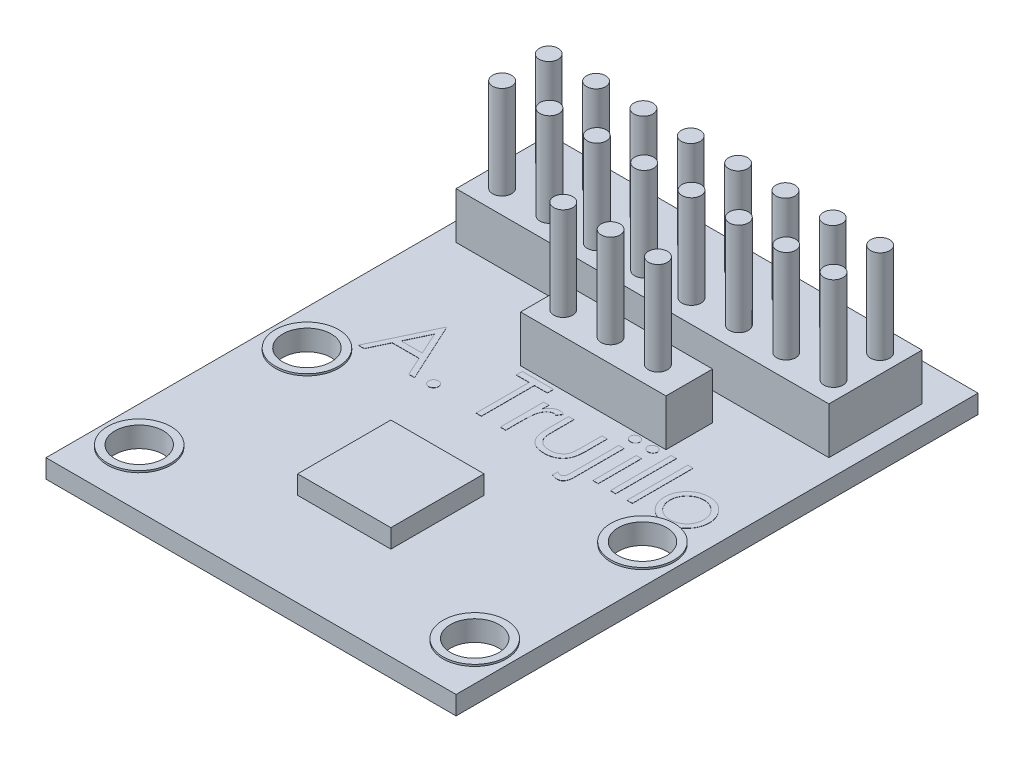
from build123d import *

# Parameters (mm, degrees)
SKETCH1_W           = 22
SKETCH1_H           = 28
BOSS_EXTRUDE1_DEPTH = 1
SKETCH2_W           = 20
SKETCH2_H           = 5
BOSS_EXTRUDE2_DEPTH = 2.5
SKETCH3_R           = 0.51
BOSS_EXTRUDE3_DEPTH = 5
SKETCH4_W           = 5
SKETCH4_H           = 5
BOSS_EXTRUDE4_DEPTH = 1
SKETCH5_R           = 1.3
CUT_EXTRUDE1_DEPTH  = 1
BOSS_EXTRUDE5_START = 0.1
SKETCH6_R           = 1.7
SKETCH6_R_2         = 1.3
BOSS_EXTRUDE5_DEPTH = 0.1
SKETCH7_W           = 7.8
SKETCH7_H           = 2.5
BOSS_EXTRUDE6_DEPTH = 2.5
SKETCH8_R           = 0.51
BOSS_EXTRUDE7_DEPTH = 5
SKETCH9_W           = 0.284935898
SKETCH9_H           = 2.320192308
SKETCH9_W_2         = 0.284935897
SKETCH9_H_2         = 3.256410256
BOSS_EXTRUDE8_DEPTH = 0.01


with BuildPart() as part:
    # Sketch1 → Boss-Extrude1 (new body)
    with BuildSketch(Plane(origin=(0, 0, 0), x_dir=(1, 0, 0), z_dir=(0, 1, 0))):
        Rectangle(SKETCH1_W, SKETCH1_H)
    extrude(amount=BOSS_EXTRUDE1_DEPTH)

    # Sketch2 → Boss-Extrude2 (add)
    with BuildSketch(Plane(origin=(0, 1, 0), x_dir=(1, 0, 0), z_dir=(0, 1, 0))):
        with Locations((0, 9.5)):
            Rectangle(SKETCH2_W, SKETCH2_H)
    extrude(amount=BOSS_EXTRUDE2_DEPTH)

    # Sketch3 → Boss-Extrude3 (add)
    with BuildSketch(Plane(origin=(0, 3.5, 0), x_dir=(1, 0, 0), z_dir=(0, 1, 0))):
        with Locations(Location((9, 8.25, 0), (0, 0, 270))):
            Circle(SKETCH3_R)
        with Locations(Location((6.46, 8.25, 0), (0, 0, 270))):
            Circle(SKETCH3_R)
        with Locations(Location((3.92, 8.25, 0), (0, 0, 270))):
            Circle(SKETCH3_R)
        with Locations(Location((1.38, 8.25, 0), (0, 0, 270))):
            Circle(SKETCH3_R)
        with Locations(Location((-1.16, 8.25, 0), (0, 0, 270))):
            Circle(SKETCH3_R)
        with Locations(Location((-3.7, 8.25, 0), (0, 0, 270))):
            Circle(SKETCH3_R)
        with Locations(Location((-6.24, 8.25, 0), (0, 0, 270))):
            Circle(SKETCH3_R)
        with Locations(Location((-8.78, 8.25, 0), (0, 0, 270))):
            Circle(SKETCH3_R)
        with Locations(Location((-8.78, 10.75, 0), (0, 0, 90))):
            Circle(SKETCH3_R)
        with Locations(Location((-6.24, 10.75, 0), (0, 0, 90))):
            Circle(SKETCH3_R)
        with Locations(Location((-3.7, 10.75, 0), (0, 0, 90))):
            Circle(SKETCH3_R)
        with Locations(Location((-1.16, 10.75, 0), (0, 0, 90))):
            Circle(SKETCH3_R)
        with Locations(Location((1.38, 10.75, 0), (0, 0, 90))):
            Circle(SKETCH3_R)
        with Locations(Location((3.92, 10.75, 0), (0, 0, 90))):
            Circle(SKETCH3_R)
        with Locations(Location((6.46, 10.75, 0), (0, 0, 90))):
            Circle(SKETCH3_R)
        with Locations(Location((9, 10.75, 0), (0, 0, 90))):
            Circle(SKETCH3_R)
    extrude(amount=BOSS_EXTRUDE3_DEPTH)

    # Sketch4 → Boss-Extrude4 (add)
    with BuildSketch(Plane(origin=(0, 1, 0), x_dir=(1, 0, 0), z_dir=(0, 1, 0))):
        with Locations((0, -6.5)):
            Rectangle(SKETCH4_W, SKETCH4_H)
    extrude(amount=BOSS_EXTRUDE4_DEPTH)

    # Sketch5 → Cut-Extrude1 (cut)
    with BuildSketch(Plane(origin=(0, 1, 0), x_dir=(1, 0, 0), z_dir=(0, 1, 0))):
        with Locations(Location((-9, -2, 0), (0, 0, 270))):
            Circle(SKETCH5_R)
        with Locations(Location((9, -2, 0), (0, 0, 90))):
            Circle(SKETCH5_R)
        with Locations(Location((9, -11, 0), (0, 0, 270))):
            Circle(SKETCH5_R)
        with Locations(Location((-9, -11, 0), (0, 0, 90))):
            Circle(SKETCH5_R)
    extrude(amount=-CUT_EXTRUDE1_DEPTH, mode=Mode.SUBTRACT)

    # Sketch6 → Boss-Extrude5 (add)
    # profile 1 of 4: a face of its own
    with BuildSketch(Plane(origin=(0, 1, 0), x_dir=(1, 0, 0), z_dir=(0, 1, 0)).offset(BOSS_EXTRUDE5_START)):
        with Locations(Location((-9, -2, 0), (0, 0, 270))):
            Circle(SKETCH6_R)
        with Locations(Location((-9, -2, 0), (0, 0, 270))):
            Circle(SKETCH6_R_2, mode=Mode.SUBTRACT)
    # profile 2 of 4: a face of its own
    with BuildSketch(Plane(origin=(0, 1, 0), x_dir=(1, 0, 0), z_dir=(0, 1, 0)).offset(BOSS_EXTRUDE5_START)):
        with Locations(Location((9, -2, 0), (0, 0, 270))):
            Circle(SKETCH6_R)
        with Locations(Location((9, -2, 0), (0, 0, 270))):
            Circle(SKETCH6_R_2, mode=Mode.SUBTRACT)
    # profile 3 of 4: a face of its own
    with BuildSketch(Plane(origin=(0, 1, 0), x_dir=(1, 0, 0), z_dir=(0, 1, 0)).offset(BOSS_EXTRUDE5_START)):
        with Locations(Location((-9, -11, 0), (0, 0, 270))):
            Circle(SKETCH6_R)
        with Locations(Location((-9, -11, 0), (0, 0, 270))):
            Circle(SKETCH6_R_2, mode=Mode.SUBTRACT)
    # profile 4 of 4: a face of its own
    with BuildSketch(Plane(origin=(0, 1, 0), x_dir=(1, 0, 0), z_dir=(0, 1, 0)).offset(BOSS_EXTRUDE5_START)):
        with Locations(Location((9, -11, 0), (0, 0, 270))):
            Circle(SKETCH6_R)
        with Locations(Location((9, -11, 0), (0, 0, 270))):
            Circle(SKETCH6_R_2, mode=Mode.SUBTRACT)
    extrude(amount=-BOSS_EXTRUDE5_DEPTH)

    # Sketch7 → Boss-Extrude6 (add)
    with BuildSketch(Plane(origin=(0, 1, 0), x_dir=(1, 0, 0), z_dir=(0, 1, 0))):
        with Locations((1.36, 4.25)):
            Rectangle(SKETCH7_W, SKETCH7_H)
    extrude(amount=BOSS_EXTRUDE6_DEPTH)

    # Sketch8 → Boss-Extrude7 (add)
    with BuildSketch(Plane(origin=(0, 3.5, 0), x_dir=(1, 0, 0), z_dir=(0, 1, 0))):
        with Locations(Location((-1.5, 4.25, 0), (0, 0, 270))):
            Circle(SKETCH8_R)
        with Locations(Location((1.04, 4.25, 0), (0, 0, 270))):
            Circle(SKETCH8_R)
        with Locations(Location((3.58, 4.25, 0), (0, 0, 270))):
            Circle(SKETCH8_R)
    extrude(amount=BOSS_EXTRUDE7_DEPTH)

    # Sketch9 → Boss-Extrude8 (add)
    # profile 1 of 12: a face of its own
    with BuildSketch(Plane(origin=(0, 1, 0), x_dir=(1, 0, 0), z_dir=(0, 1, 0))):
        Polygon((-6.290384615, 2.775), (-4.825, -0.4), (-5.134740585, -0.4), (-5.604121595, 0.617628205), (-7.043429487, 0.617628205), (-7.526166867, -0.4), (-7.837179487, -0.4), (-6.331089744, 2.775), align=None)
        Polygon((-6.313917268, 2.156154848), (-6.888877204, 0.943269231), (-5.754221755, 0.943269231), align=None, mode=Mode.SUBTRACT)
    # profile 2 of 12: a face of its own
    with BuildSketch(Plane(origin=(0, 1, 0), x_dir=(1, 0, 0), z_dir=(0, 1, 0))):
        with BuildLine():
            add(Edge.make_bspline(
                [(-4.03125, 0.088461538), (-4.013569593, 0.087410916), (-3.978909223, 0.085351293), (-3.928799442, 0.071221025), (-3.883447144, 0.046130668), (-3.843050036, 0.012690862), (-3.809752018, -0.027854489), (-3.783767498, -0.072845064), (-3.769760319, -0.123374365), (-3.767715699, -0.158235571), (-3.766666667, -0.176121795)],
                knots=[0, 0, 0, 0, 1.020151414, 1.999887582, 2.974338812, 3.990962822, 5.007586832, 5.987933904, 6.967670073, 8, 8, 8, 8], degree=3))
            add(Edge.make_bspline(
                [(-3.766666667, -0.176121795), (-3.767751247, -0.193578244), (-3.769890025, -0.228002105), (-3.78373539, -0.278150289), (-3.80995005, -0.323168981), (-3.842820365, -0.364264492), (-3.88345713, -0.397775139), (-3.928906662, -0.42265203), (-3.978791589, -0.437794041), (-4.013549968, -0.439722896), (-4.03125, -0.440705128)],
                knots=[0, 0, 0, 0, 1.009421747, 1.99056486, 2.972319754, 3.999869655, 5.017953583, 5.993804169, 6.978383603, 8, 8, 8, 8], degree=3))
            add(Edge.make_bspline(
                [(-4.03125, -0.440705128), (-4.048962786, -0.439758436), (-4.083542784, -0.437910246), (-4.133241507, -0.422341129), (-4.178967828, -0.398008419), (-4.219596681, -0.364202008), (-4.252742295, -0.323380449), (-4.277802464, -0.277840248), (-4.292852099, -0.228145659), (-4.294831369, -0.193606518), (-4.295833333, -0.176121795)],
                knots=[0, 0, 0, 0, 1.022052826, 1.995314843, 2.982371812, 4.00089066, 5.028879526, 6.005146991, 6.990147033, 8, 8, 8, 8], degree=3))
            add(Edge.make_bspline(
                [(-4.295833333, -0.176121795), (-4.294869858, -0.158206286), (-4.292988789, -0.123228454), (-4.277770869, -0.073154978), (-4.252936734, -0.027645037), (-4.219367554, 0.012629004), (-4.178977657, 0.0463632), (-4.133351814, 0.070914834), (-4.083423088, 0.085465779), (-4.048942644, 0.087445633), (-4.03125, 0.088461538)],
                knots=[0, 0, 0, 0, 1.032775665, 2.016367738, 2.991239715, 4.008302682, 5.025365648, 6.011011707, 6.979408107, 8, 8, 8, 8], degree=3))
        make_face()
    # profile 3 of 12: a face of its own
    with BuildSketch(Plane(origin=(0, 1, 0), x_dir=(1, 0, 0), z_dir=(0, 1, 0))):
        Polygon((-2.219871795, 2.449358974), (-2.219871795, 2.775), (-0.550961538, 2.775), (-0.550961538, 2.449358974), (-1.242948718, 2.449358974), (-1.242948718, -0.4), (-1.527884615, -0.4), (-1.527884615, 2.449358974), align=None)
    # profile 4 of 12: a face of its own
    with BuildSketch(Plane(origin=(0, 1, 0), x_dir=(1, 0, 0), z_dir=(0, 1, 0))):
        with BuildLine():
            Line((-0.225320513, 1.920192308), (0.059615385, 1.920192308))
            Line((0.059615385, 1.920192308), (0.059615385, 1.578650841))
            add(Edge.make_bspline(
                [(0.059615385, 1.578650841), (0.080650901, 1.610451486), (0.120881164, 1.671269971), (0.187749321, 1.751705694), (0.256241629, 1.818303629), (0.326685978, 1.871374678), (0.399600397, 1.911119436), (0.473384632, 1.940232403), (0.549199522, 1.957447539), (0.60014641, 1.95974593), (0.625671074, 1.960897436)],
                knots=[0, 0, 0, 0, 1.2804753, 2.448899062, 3.506932113, 4.484331642, 5.4025378, 6.288909075, 7.142734305, 8, 8, 8, 8], degree=3))
            add(Edge.make_bspline(
                [(0.625671074, 1.960897436), (0.64547067, 1.959817458), (0.686209626, 1.957595334), (0.747879547, 1.941982657), (0.811418964, 1.917056165), (0.852369558, 1.893615392), (0.873717949, 1.881395232)],
                knots=[0, 0, 0, 0, 0.901110191, 1.854092781, 2.881294221, 4, 4, 4, 4], degree=3))
            Line((0.873717949, 1.881395232), (0.717257612, 1.634620393))
            add(Edge.make_bspline(
                [(0.717257612, 1.634620393), (0.703551572, 1.640734777), (0.677534883, 1.652341049), (0.639476098, 1.666077015), (0.604386599, 1.674165024), (0.582031371, 1.675390318), (0.571609575, 1.675961538)],
                knots=[0, 0, 0, 0, 1.180555205, 2.24091978, 3.179933427, 4, 4, 4, 4], degree=3))
            add(Edge.make_bspline(
                [(0.571609575, 1.675961538), (0.548744374, 1.674437505), (0.502105992, 1.671328917), (0.433630767, 1.64689157), (0.367185088, 1.607407959), (0.31441508, 1.563619165), (0.273555322, 1.521393663), (0.244399546, 1.484519755), (0.217654483, 1.443173425), (0.192100069, 1.398061498), (0.168817073, 1.348413709), (0.147086766, 1.294726079), (0.127439083, 1.236936427), (0.116235648, 1.196675141), (0.110496795, 1.176051683)],
                knots=[0, 0, 0, 0, 1.125678352, 2.296057538, 3.5422874, 4.923748041, 5.663163013, 6.437101912, 7.23742474, 8.08941207, 8.991984279, 9.93940061, 10.944477711, 12, 12, 12, 12], degree=3))
            add(Edge.make_bspline(
                [(0.110496795, 1.176051683), (0.106203838, 1.15765739), (0.096695265, 1.116915428), (0.087450084, 1.048563552), (0.078315593, 0.967806376), (0.071877946, 0.874419109), (0.065910722, 0.768634964), (0.062545148, 0.650292785), (0.059730156, 0.519271102), (0.059654802, 0.427672938), (0.059615385, 0.379757612)],
                knots=[0, 0, 0, 0, 0.566838948, 1.255505196, 2.06880316, 3.007127437, 4.065329342, 5.249902469, 6.561414163, 8, 8, 8, 8], degree=3))
            Line((0.059615385, 0.379757612), (0.059615385, -0.4))
            Line((0.059615385, -0.4), (-0.225320513, -0.4))
            Line((-0.225320513, -0.4), (-0.225320513, 1.920192308))
        make_face()
    # profile 5 of 12: a face of its own
    with BuildSketch(Plane(origin=(0, 1, 0), x_dir=(1, 0, 0), z_dir=(0, 1, 0))):
        with BuildLine():
            Line((1.117948718, 1.920192308), (1.402884615, 1.920192308))
            Line((1.402884615, 1.920192308), (1.402884615, 0.844050481))
            add(Edge.make_bspline(
                [(1.402884615, 0.844050481), (1.403013343, 0.812461273), (1.403259594, 0.752032597), (1.40492959, 0.665078249), (1.408857604, 0.585778803), (1.413768716, 0.514088448), (1.420084368, 0.450019315), (1.42759856, 0.393795184), (1.435997271, 0.34477846), (1.444218447, 0.315256987), (1.448041867, 0.301527444)],
                knots=[0, 0, 0, 0, 1.388932606, 2.656963016, 3.823490214, 4.879454478, 5.816252168, 6.653371382, 7.373723809, 8, 8, 8, 8], degree=3))
            add(Edge.make_bspline(
                [(1.448041867, 0.301527444), (1.454175473, 0.284270982), (1.466315168, 0.250116817), (1.488334685, 0.200778219), (1.515574676, 0.155080642), (1.545383234, 0.111261947), (1.579763411, 0.070620145), (1.618280217, 0.033223867), (1.659644332, -0.002339845), (1.721107818, -0.044417477), (1.805163009, -0.089516384), (1.915519437, -0.128429019), (2.035175413, -0.15168437), (2.117874837, -0.154382444), (2.160381611, -0.155769231)],
                knots=[0, 0, 0, 0, 0.725840625, 1.436591201, 2.137033971, 2.831655856, 3.53531722, 4.242432219, 4.957935707, 5.694543706, 7.190802206, 8.724350549, 10.316345118, 12, 12, 12, 12], degree=3))
            add(Edge.make_bspline(
                [(2.160381611, -0.155769231), (2.202884435, -0.154352955), (2.285119537, -0.151612724), (2.403460831, -0.129130514), (2.5116389, -0.091569639), (2.608567977, -0.039130058), (2.693808418, 0.025043099), (2.764841712, 0.100343946), (2.823449721, 0.184390176), (2.849039696, 0.247095772), (2.861909054, 0.278630809)],
                knots=[0, 0, 0, 0, 1.157059328, 2.238695713, 3.266970494, 4.264342957, 5.228770407, 6.160125903, 7.074715775, 8, 8, 8, 8], degree=3))
            add(Edge.make_bspline(
                [(2.861909054, 0.278630809), (2.86571382, 0.291300237), (2.874125228, 0.319309249), (2.883162504, 0.366825163), (2.891303623, 0.423489483), (2.898255219, 0.489673001), (2.903212902, 0.565202761), (2.905885369, 0.650055158), (2.90890459, 0.743963821), (2.908950415, 0.809702431), (2.908974359, 0.844050481)],
                knots=[0, 0, 0, 0, 0.557542046, 1.232589297, 2.036731608, 2.971723315, 4.038036528, 5.22795436, 6.551621927, 8, 8, 8, 8], degree=3))
            Line((2.908974359, 0.844050481), (2.908974359, 1.920192308))
            Line((2.908974359, 1.920192308), (3.193910256, 1.920192308))
            Line((3.193910256, 1.920192308), (3.193910256, 0.790625))
            add(Edge.make_bspline(
                [(3.193910256, 0.790625), (3.193509576, 0.752246352), (3.192732202, 0.677786524), (3.187736254, 0.569578794), (3.179164106, 0.468738758), (3.166153241, 0.375213037), (3.150853665, 0.289073036), (3.131117617, 0.210208352), (3.107551645, 0.138861971), (3.080967356, 0.073781931), (3.049560376, 0.014775105), (3.016153008, -0.0412281), (2.977576965, -0.092838119), (2.936963966, -0.142624058), (2.89178675, -0.188109587), (2.842891878, -0.230338425), (2.790967547, -0.269956104), (2.734861489, -0.305417479), (2.675392775, -0.337364007), (2.61248799, -0.36568145), (2.545376656, -0.388090216), (2.474924642, -0.407422034), (2.400786778, -0.422584446), (2.323034536, -0.433276545), (2.241694106, -0.439830953), (2.186259096, -0.440408843), (2.15783754, -0.440705128)],
                knots=[0, 0, 0, 0, 1.493040784, 2.896703357, 4.213163133, 5.428574705, 6.569057535, 7.615249723, 8.588095153, 9.490268104, 10.346124644, 11.18633936, 12.024365274, 12.850166724, 13.684164916, 14.514361689, 15.362232829, 16.222528818, 17.093394965, 17.986930858, 18.902426812, 19.842810585, 20.827885679, 21.843828298, 22.894529745, 24, 24, 24, 24], degree=3))
            add(Edge.make_bspline(
                [(2.15783754, -0.440705128), (2.129628559, -0.440396965), (2.074195286, -0.439791396), (1.992850658, -0.433312757), (1.914882993, -0.422601059), (1.840569489, -0.407310969), (1.769835571, -0.388225527), (1.702394725, -0.365543748), (1.639036636, -0.337349311), (1.579000104, -0.30561967), (1.52275508, -0.269728313), (1.470042299, -0.230387306), (1.42093244, -0.187655377), (1.375414671, -0.141710989), (1.334127899, -0.091984196), (1.296557633, -0.03887501), (1.262125479, 0.017090342), (1.23096259, 0.077019068), (1.204191212, 0.142852249), (1.180555382, 0.215693187), (1.161223589, 0.29634047), (1.145491492, 0.384725148), (1.132835543, 0.480424221), (1.124048828, 0.583991284), (1.119135896, 0.695174061), (1.118352976, 0.771963605), (1.117948718, 0.811613582)],
                knots=[0, 0, 0, 0, 1.083640291, 2.129454052, 3.13281866, 4.105697902, 5.042300162, 5.946461698, 6.836384745, 7.703652036, 8.553297018, 9.397182691, 10.228592656, 11.052265423, 11.879314572, 12.708807002, 13.549817954, 14.402308542, 15.300838682, 16.27712199, 17.341985831, 18.484375296, 19.725102775, 21.0496083, 22.476576903, 24, 24, 24, 24], degree=3))
            Line((1.117948718, 0.811613582), (1.117948718, 1.920192308))
        make_face()
    # profile 6 of 12: a face of its own
    with BuildSketch(Plane(origin=(0, 1, 0), x_dir=(1, 0, 0), z_dir=(0, 1, 0))):
        with BuildLine():
            add(Edge.make_bspline(
                [(3.946955128, 2.897115385), (3.964844632, 2.896301242), (3.999673067, 2.894716217), (4.049844476, 2.881099846), (4.094985299, 2.857386423), (4.135408102, 2.826583645), (4.169313863, 2.789305864), (4.193927924, 2.746840161), (4.208489214, 2.700234886), (4.210508366, 2.668038142), (4.211538462, 2.65161258)],
                knots=[0, 0, 0, 0, 1.06928763, 2.081757757, 3.080304056, 4.102817284, 5.108909582, 6.075019406, 7.017947647, 8, 8, 8, 8], degree=3))
            add(Edge.make_bspline(
                [(4.211538462, 2.65161258), (4.210488325, 2.63561376), (4.20841659, 2.604050893), (4.193938765, 2.558247277), (4.169108267, 2.516376936), (4.135430802, 2.479171593), (4.09497934, 2.448386481), (4.04984607, 2.424668402), (3.999672639, 2.411053277), (3.964844487, 2.409468078), (3.946955128, 2.408653846)],
                knots=[0, 0, 0, 0, 0.962634111, 1.899108286, 2.860048811, 3.872254101, 4.900980094, 5.905593535, 6.924215405, 8, 8, 8, 8], degree=3))
            add(Edge.make_bspline(
                [(3.946955128, 2.408653846), (3.929065769, 2.409468078), (3.894237617, 2.411053277), (3.844064186, 2.424668402), (3.798930916, 2.448386481), (3.758479455, 2.479171593), (3.72480199, 2.516376936), (3.699971492, 2.558247277), (3.685493667, 2.604050893), (3.683421931, 2.63561376), (3.682371795, 2.65161258)],
                knots=[0, 0, 0, 0, 1.075784595, 2.094406465, 3.099019906, 4.127745899, 5.139951189, 6.100891714, 7.037365889, 8, 8, 8, 8], degree=3))
            add(Edge.make_bspline(
                [(3.682371795, 2.65161258), (3.68340189, 2.668038142), (3.685421042, 2.700234886), (3.699982332, 2.746840161), (3.724596393, 2.789305864), (3.758502154, 2.826583645), (3.798924958, 2.857386423), (3.844065781, 2.881099846), (3.89423719, 2.894716217), (3.929065624, 2.896301242), (3.946955128, 2.897115385)],
                knots=[0, 0, 0, 0, 0.982052353, 1.924980594, 2.891090418, 3.897182716, 4.919695944, 5.918242243, 6.93071237, 8, 8, 8, 8], degree=3))
        make_face()
    # profile 7 of 12: a face of its own
    with BuildSketch(Plane(origin=(0, 1, 0), x_dir=(1, 0, 0), z_dir=(0, 1, 0))):
        with BuildLine():
            Line((3.804487179, 1.920192308), (4.089423077, 1.920192308))
            Line((4.089423077, 1.920192308), (4.089423077, -0.738997396))
            add(Edge.make_bspline(
                [(4.089423077, -0.738997396), (4.089332128, -0.762543685), (4.089157362, -0.807790032), (4.08355857, -0.873126571), (4.076295731, -0.933703109), (4.065705325, -0.989449357), (4.051692947, -1.040319581), (4.034491536, -1.085988372), (4.015142869, -1.127421868), (3.991180759, -1.163108424), (3.965126068, -1.194427666), (3.936750989, -1.221527429), (3.906210926, -1.244748826), (3.872788376, -1.262979637), (3.837570782, -1.278101428), (3.799803261, -1.287846972), (3.760003002, -1.294698271), (3.73264868, -1.295236754), (3.7186248, -1.295512821)],
                knots=[0, 0, 0, 0, 1.493029139, 2.868991889, 4.156754484, 5.362105958, 6.464967428, 7.499106053, 8.455465818, 9.358121702, 10.217355437, 11.035397588, 11.842309395, 12.643033568, 13.444773531, 14.266895717, 15.11148054, 16, 16, 16, 16], degree=3))
            add(Edge.make_bspline(
                [(3.7186248, -1.295512821), (3.693966134, -1.294660842), (3.643002913, -1.292900019), (3.564737446, -1.277501864), (3.481894906, -1.254874533), (3.426311346, -1.233483404), (3.397435897, -1.222370793)],
                knots=[0, 0, 0, 0, 0.892368802, 1.844300437, 2.88012224, 4, 4, 4, 4], degree=3))
            Line((3.397435897, -1.222370793), (3.397435897, -0.948247196))
            add(Edge.make_bspline(
                [(3.397435897, -0.948247196), (3.41545271, -0.957855682), (3.449830753, -0.976189721), (3.50244422, -0.994748605), (3.551728083, -1.008347444), (3.584131659, -1.009853719), (3.599689503, -1.010576923)],
                knots=[0, 0, 0, 0, 1.144578483, 2.183980519, 3.128079311, 4, 4, 4, 4], degree=3))
            add(Edge.make_bspline(
                [(3.599689503, -1.010576923), (3.617677073, -1.009421716), (3.652367083, -1.007193836), (3.700738004, -0.987968404), (3.741514316, -0.955337613), (3.76033218, -0.926010723), (3.770142228, -0.910722155)],
                knots=[0, 0, 0, 0, 1.036054724, 1.998088038, 2.956371939, 4, 4, 4, 4], degree=3))
            add(Edge.make_bspline(
                [(3.770142228, -0.910722155), (3.775712416, -0.897297287), (3.788746637, -0.86588314), (3.797650118, -0.807107044), (3.803895746, -0.732378348), (3.804277615, -0.676696339), (3.804487179, -0.646138822)],
                knots=[0, 0, 0, 0, 0.647276487, 1.514624746, 2.636060416, 4, 4, 4, 4], degree=3))
            Line((3.804487179, -0.646138822), (3.804487179, 1.920192308))
        make_face()
    # profile 8 of 12: a face of its own
    with BuildSketch(Plane(origin=(0, 1, 0), x_dir=(1, 0, 0), z_dir=(0, 1, 0))):
        with BuildLine():
            add(Edge.make_bspline(
                [(4.881901042, 2.897115385), (4.89958245, 2.896295189), (4.934206042, 2.894689089), (4.984274221, 2.880935463), (5.02986451, 2.857622177), (5.070302882, 2.826344181), (5.105002808, 2.789560043), (5.129296738, 2.746687593), (5.14491084, 2.700370114), (5.146796387, 2.66806214), (5.14775641, 2.65161258)],
                knots=[0, 0, 0, 0, 1.055194115, 2.066272739, 3.074728998, 4.095836921, 5.109056067, 6.073838105, 7.019297344, 8, 8, 8, 8], degree=3))
            add(Edge.make_bspline(
                [(5.14775641, 2.65161258), (5.146774737, 2.63559003), (5.144834084, 2.603915346), (5.129308798, 2.558400839), (5.104795768, 2.516124096), (5.070325133, 2.479411381), (5.029858614, 2.448150675), (4.984275787, 2.424832805), (4.93420563, 2.411080395), (4.89958231, 2.409474127), (4.881901042, 2.408653846)],
                knots=[0, 0, 0, 0, 0.96129708, 1.900370562, 2.859976407, 3.87933698, 4.906634145, 5.921202961, 6.938410037, 8, 8, 8, 8], degree=3))
            add(Edge.make_bspline(
                [(4.881901042, 2.408653846), (4.864421963, 2.409442807), (4.830401221, 2.410978415), (4.781082729, 2.425102646), (4.735881171, 2.448158655), (4.695363932, 2.479206694), (4.661590828, 2.516349565), (4.637008776, 2.558375039), (4.621519346, 2.603921915), (4.619573861, 2.635592237), (4.618589744, 2.65161258)],
                knots=[0, 0, 0, 0, 1.054934014, 2.053291228, 3.073705704, 4.106921865, 5.123545215, 6.088680038, 7.033164197, 8, 8, 8, 8], degree=3))
            add(Edge.make_bspline(
                [(4.618589744, 2.65161258), (4.619552301, 2.668059851), (4.621442824, 2.700363328), (4.637020386, 2.746713822), (4.661386069, 2.789332756), (4.695386294, 2.826548745), (4.735875219, 2.857614247), (4.781084267, 2.880665637), (4.830400815, 2.894791066), (4.864421826, 2.896326509), (4.881901042, 2.897115385)],
                knots=[0, 0, 0, 0, 0.98631895, 1.937192651, 2.907499808, 3.917963147, 4.944918757, 5.95915025, 6.951458133, 8, 8, 8, 8], degree=3))
        make_face()
    # profile 9 of 12: a face of its own
    with BuildSketch(Plane(origin=(0, 1, 0), x_dir=(1, 0, 0), z_dir=(0, 1, 0))):
        with Locations((4.883173077, 0.760096154)):
            Rectangle(SKETCH9_W, SKETCH9_H)
    # profile 10 of 12: a face of its own
    with BuildSketch(Plane(origin=(0, 1, 0), x_dir=(1, 0, 0), z_dir=(0, 1, 0))):
        with Locations((5.819391025, 1.228205128)):
            Rectangle(SKETCH9_W_2, SKETCH9_H_2)
    # profile 11 of 12: a face of its own
    with BuildSketch(Plane(origin=(0, 1, 0), x_dir=(1, 0, 0), z_dir=(0, 1, 0))):
        with Locations((6.714903846, 1.228205128)):
            Rectangle(SKETCH9_W, SKETCH9_H_2)
    # profile 12 of 12: a face of its own
    with BuildSketch(Plane(origin=(0, 1, 0), x_dir=(1, 0, 0), z_dir=(0, 1, 0))):
        with BuildLine():
            add(Edge.make_bspline(
                [(8.629316907, 1.960897436), (8.672851847, 1.959970435), (8.758213226, 1.958152812), (8.883224665, 1.938726379), (9.002554896, 1.909019841), (9.116660942, 1.867952067), (9.224081438, 1.812904869), (9.326381067, 1.747219298), (9.423279353, 1.669402231), (9.481357387, 1.609205983), (9.51083734, 1.578650841)],
                knots=[0, 0, 0, 0, 1.054011418, 2.066658804, 3.057071809, 4.030435133, 4.997543892, 5.974964718, 6.972108034, 8, 8, 8, 8], degree=3))
            add(Edge.make_bspline(
                [(9.51083734, 1.578650841), (9.53622097, 1.549428154), (9.586496986, 1.49154832), (9.650963745, 1.397699299), (9.706500446, 1.300507922), (9.751007561, 1.198683562), (9.786100404, 1.09311511), (9.811015714, 0.983439714), (9.825835648, 0.869899585), (9.827834053, 0.79278896), (9.828846154, 0.753735978)],
                knots=[0, 0, 0, 0, 1.025258237, 2.030674902, 3.01204498, 3.988269485, 4.97094183, 5.956517959, 6.965070386, 8, 8, 8, 8], degree=3))
            add(Edge.make_bspline(
                [(9.828846154, 0.753735978), (9.827955941, 0.71445664), (9.826196838, 0.636838836), (9.809556557, 0.522521268), (9.783674787, 0.411673108), (9.746634476, 0.304758435), (9.699138192, 0.201450442), (9.641180211, 0.102200351), (9.572353815, 0.006812344), (9.494335904, -0.083903609), (9.408110273, -0.167511532), (9.314569196, -0.240380748), (9.215550894, -0.302811703), (9.109738709, -0.353100451), (8.998098917, -0.392751394), (8.88039072, -0.420600694), (8.756796978, -0.437438793), (8.672407998, -0.439601034), (8.629316907, -0.440705128)],
                knots=[0, 0, 0, 0, 0.998656419, 1.973391657, 2.932242238, 3.890759089, 4.846373663, 5.82037756, 6.809684879, 7.83454468, 8.860553229, 9.859544525, 10.845671541, 11.83227036, 12.833544569, 13.85385346, 14.904124723, 16, 16, 16, 16], degree=3))
            add(Edge.make_bspline(
                [(8.629316907, -0.440705128), (8.586014697, -0.439597329), (8.501205132, -0.437427648), (8.377175134, -0.420666113), (8.259255979, -0.392764228), (8.147470036, -0.352970146), (8.041202925, -0.302810095), (7.941610889, -0.240569491), (7.847993823, -0.167489922), (7.761749951, -0.083909465), (7.68373693, 0.006813853), (7.614909273, 0.102199959), (7.55695162, 0.201450544), (7.509455249, 0.304758408), (7.472414962, 0.411673115), (7.446533185, 0.522521266), (7.429892906, 0.636838836), (7.428133803, 0.71445664), (7.42724359, 0.753735978)],
                knots=[0, 0, 0, 0, 1.099876186, 2.154163076, 3.173186993, 4.173200201, 5.163417411, 6.152872554, 7.150605724, 8.17532212, 9.198891216, 10.186952605, 11.159729845, 12.11414092, 13.071450619, 14.029093627, 15.002601286, 16, 16, 16, 16], degree=3))
            add(Edge.make_bspline(
                [(7.42724359, 0.753735978), (7.428262593, 0.792576701), (7.430280043, 0.869474659), (7.445085077, 0.98280135), (7.469903196, 1.092291124), (7.505038105, 1.197452092), (7.549955457, 1.298830237), (7.604711768, 1.396261763), (7.669836128, 1.48968641), (7.719912184, 1.54749144), (7.745252404, 1.576742788)],
                knots=[0, 0, 0, 0, 1.031353054, 2.041901799, 3.029428768, 4.008703097, 4.981709435, 5.96992636, 6.972712378, 8, 8, 8, 8], degree=3))
            add(Edge.make_bspline(
                [(7.745252404, 1.576742788), (7.774687911, 1.607562912), (7.832578016, 1.668176108), (7.929958648, 1.745766326), (8.032006614, 1.812818764), (8.140614226, 1.866772189), (8.254626533, 1.909261415), (8.374568274, 1.93880299), (8.50000392, 1.958082819), (8.585783005, 1.95994988), (8.629316907, 1.960897436)],
                knots=[0, 0, 0, 0, 1.027980169, 2.021703884, 2.998553061, 3.971491411, 4.943284454, 5.930300938, 6.949603206, 8, 8, 8, 8], degree=3))
        make_face()
        with BuildLine():
            add(Edge.make_bspline(
                [(8.628044872, 1.675961538), (8.59725861, 1.675086516), (8.536480829, 1.67335906), (8.447018777, 1.660220089), (8.360894495, 1.639403425), (8.277944586, 1.609826888), (8.19844878, 1.571637172), (8.122330965, 1.524730303), (8.049367251, 1.469727549), (7.980984951, 1.406714983), (7.918226711, 1.337881895), (7.863364546, 1.264540884), (7.816714628, 1.187881555), (7.777852484, 1.107824192), (7.748908106, 1.023557503), (7.727886865, 0.936035787), (7.714760289, 0.845080731), (7.713049074, 0.78324895), (7.712179487, 0.751827925)],
                knots=[0, 0, 0, 0, 1.021534396, 2.016698045, 2.994645724, 3.958388632, 4.93408049, 5.916473867, 6.921342795, 7.962252576, 8.998418191, 10.008913653, 10.997312074, 11.973003931, 12.956656626, 13.948281152, 14.957379055, 16, 16, 16, 16], degree=3))
            add(Edge.make_bspline(
                [(7.712179487, 0.751827925), (7.713637106, 0.711231443), (7.716530206, 0.630655018), (7.740057171, 0.511990642), (7.779414724, 0.398069962), (7.832561757, 0.289560812), (7.899151684, 0.189165246), (7.977607808, 0.099656113), (8.067088108, 0.022380413), (8.166525933, -0.041737211), (8.273890207, -0.092682133), (8.387515584, -0.128785489), (8.506025357, -0.15225481), (8.587015734, -0.154587505), (8.628044872, -0.155769231)],
                knots=[0, 0, 0, 0, 1.016792936, 2.018143844, 3.017858371, 4.030088057, 5.03801393, 6.028138512, 7.003788237, 7.991172063, 8.984598303, 9.972568034, 10.972917682, 12, 12, 12, 12], degree=3))
            add(Edge.make_bspline(
                [(8.628044872, -0.155769231), (8.669071649, -0.154580619), (8.750057369, -0.152234334), (8.868402479, -0.12890369), (8.981717296, -0.092523941), (9.088970055, -0.041794507), (9.188362617, 0.022623898), (9.278486462, 0.099219754), (9.356272703, 0.189402319), (9.422796758, 0.289693792), (9.476814161, 0.39790174), (9.515987494, 0.512011668), (9.539571018, 0.630649663), (9.542456484, 0.711229649), (9.543910256, 0.751827925)],
                knots=[0, 0, 0, 0, 1.02726834, 2.027799167, 3.010890988, 4.004497153, 4.992059811, 5.971914811, 6.958719428, 7.966827853, 8.981595046, 9.981490638, 10.983022906, 12, 12, 12, 12], degree=3))
            add(Edge.make_bspline(
                [(9.543910256, 0.751827925), (9.543040969, 0.783249138), (9.541330343, 0.845081288), (9.528199482, 0.936033657), (9.5071941, 1.023565319), (9.478191276, 1.107795351), (9.439497992, 1.188088837), (9.391948472, 1.264315804), (9.337310328, 1.338135956), (9.273794797, 1.406492473), (9.205483875, 1.469752114), (9.132490591, 1.524751631), (9.056485646, 1.571431021), (8.977220789, 1.61015354), (8.894260245, 1.639134341), (8.808256635, 1.660340285), (8.719176286, 1.673303535), (8.658616297, 1.675069871), (8.628044872, 1.675961538)],
                knots=[0, 0, 0, 0, 1.042956736, 2.052379634, 3.044323526, 4.02829302, 5.004299113, 5.996692471, 7.007513377, 8.048758398, 9.090003419, 10.095195979, 11.07790575, 12.047570684, 13.018257071, 13.989683339, 14.985167495, 16, 16, 16, 16], degree=3))
        make_face(mode=Mode.SUBTRACT)
    extrude(amount=BOSS_EXTRUDE8_DEPTH)


solid = part.part
